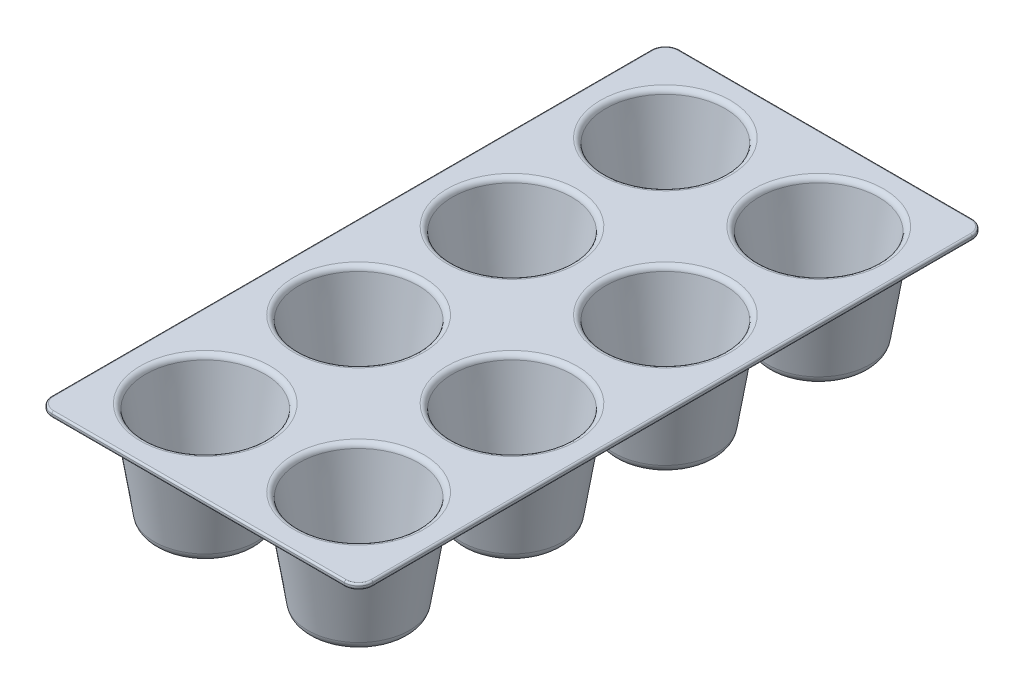
from build123d import *

# Parameters (mm, degrees)
LPATTERN1_COUNT      = 2
LPATTERN1_PITCH      = 86
LPATTERN1_COUNT_DIR2 = 4
LPATTERN1_PITCH_DIR2 = 86
BOSS_EXTRUDE1_START  = 58
BOSS_EXTRUDE1_DEPTH  = 3
FILLET1_R            = 1


with BuildPart() as part:
    # Sketch1 → Revolve1 (revolve)
    with BuildSketch(Plane.XY, mode=Mode.PRIVATE) as revolve1_sk:
        with BuildLine():
            Line((0, 0), (-22.602129613, 0))
            ThreePointArc((-22.602129613, 0), (-26.498817903, 1.437564206), (-28.528259657, 5.06139321))
            Line((-28.528259657, 5.06139321), (-36.036934978, 52.469303395))
            ThreePointArc((-36.036934978, 52.469303395), (-37.051655855, 54.281217897), (-39, 55))
            Line((-39, 55), (-47, 55))
            Line((-47, 55), (-47, 58))
            Line((-47, 58), (-36.437757944, 58))
            ThreePointArc((-36.437757944, 58), (-34.489413799, 57.281217897), (-33.474692922, 55.469303395))
            Line((-33.474692922, 55.469303395), (-25.9660176, 8.06139321))
            ThreePointArc((-25.9660176, 8.06139321), (-23.936575847, 4.437564206), (-20.039887557, 3))
            Line((-20.039887557, 3), (0, 3))
            Line((0, 3), (0, 0))
        make_face()
    revolve1 = revolve(revolve1_sk.sketch.rotate(Axis((0, 0, 0), (0, 1, 0)), 270), axis=Axis((0, 0, 0), (0, 1, 0)))

    # LPattern1: Revolve1 2 × 4
    with Locations(*[(i * LPATTERN1_PITCH, 0, -j * LPATTERN1_PITCH_DIR2) for i in range(LPATTERN1_COUNT) for j in range(LPATTERN1_COUNT_DIR2) if (i, j) != (0, 0)]):
        add(revolve1)

    # Sketch3 → Boss-Extrude1 (add)
    with BuildSketch(Plane(origin=(0, 0, 0), x_dir=(1, 0, 0), z_dir=(0, 1, 0)).offset(BOSS_EXTRUDE1_START)):
        with BuildLine():
            ThreePointArc((-47, -39), (-44.656854249, -44.656854249), (-39, -47))
            Line((-39, -47), (1.51e-07, -47))
            ThreePointArc((1.51e-07, -47), (-33.234018781, -33.234018651), (-47, 3.35e-07))
            Line((-47, 3.35e-07), (-47, -39))
        make_face()
        with BuildLine():
            ThreePointArc((43, -18.973665961), (25.663570546, -39.374879642), (1.51e-07, -47))
            Line((1.51e-07, -47), (86, -47))
            ThreePointArc((86, -47), (60.336429517, -39.374879683), (43, -18.973665961))
        make_face()
        with BuildLine():
            ThreePointArc((133, 0), (119.234018716, -33.234018716), (86, -47))
            Line((86, -47), (125, -47))
            ThreePointArc((125, -47), (130.656854249, -44.656854249), (133, -39))
            Line((133, -39), (133, 0))
        make_face()
        with BuildLine():
            ThreePointArc((104.973665961, 43), (125.374879683, 25.663570483), (133, 0))
            Line((133, 0), (133, 86))
            ThreePointArc((133, 86), (125.374879683, 60.336429517), (104.973665961, 43))
        make_face()
        with BuildLine():
            ThreePointArc((104.973665961, 129), (125.374879683, 111.663570483), (133, 86))
            Line((133, 86), (133, 172))
            ThreePointArc((133, 172), (125.374879683, 146.336429517), (104.973665961, 129))
        make_face()
        with BuildLine():
            ThreePointArc((67.026334039, 43), (52.765981284, 33.234018716), (43, 18.973665961))
            ThreePointArc((43, 18.973665961), (33.234018716, 33.234018716), (18.973665961, 43))
            ThreePointArc((18.973665961, 43), (33.234018716, 52.765981284), (43, 67.026334039))
            ThreePointArc((43, 67.026334039), (52.765981284, 52.765981284), (67.026334039, 43))
        make_face()
        with BuildLine():
            ThreePointArc((18.973665961, 129), (33.234018716, 138.765981284), (43, 153.026334039))
            ThreePointArc((43, 153.026334039), (52.765981284, 138.765981284), (67.026334039, 129))
            ThreePointArc((67.026334039, 129), (52.765981284, 119.234018716), (43, 104.973665961))
            ThreePointArc((43, 104.973665961), (33.234018716, 119.234018716), (18.973665961, 129))
        make_face()
        with BuildLine():
            Line((-47, 172), (-47, 85.999999906))
            ThreePointArc((-47, 85.999999906), (-39.374879709, 111.663570443), (-18.973665961, 129))
            ThreePointArc((-18.973665961, 129), (-39.374879683, 146.336429517), (-47, 172))
        make_face()
        with BuildLine():
            Line((-47, 85.999999906), (-47, 3.35e-07))
            ThreePointArc((-47, 3.35e-07), (-39.374879592, 25.663570623), (-18.973665961, 43))
            ThreePointArc((-18.973665961, 43), (-39.374879658, 60.336429478), (-47, 85.999999906))
        make_face()
        with BuildLine():
            ThreePointArc((104.973665961, 215), (125.374879683, 197.663570483), (133, 172))
            Line((133, 172), (133, 258))
            ThreePointArc((133, 258), (125.374879683, 232.336429517), (104.973665961, 215))
        make_face()
        with BuildLine():
            ThreePointArc((43, 190.973665961), (33.234018716, 205.234018716), (18.973665961, 215))
            ThreePointArc((18.973665961, 215), (33.234018716, 224.765981284), (43, 239.026334039))
            ThreePointArc((43, 239.026334039), (52.765981284, 224.765981284), (67.026334039, 215))
            ThreePointArc((67.026334039, 215), (52.765981284, 205.234018716), (43, 190.973665961))
        make_face()
        with BuildLine():
            Line((-47, 258.000000209), (-47, 172))
            ThreePointArc((-47, 172), (-39.374879683, 197.663570483), (-18.973665961, 215))
            ThreePointArc((-18.973665961, 215), (-39.374879741, 232.336429605), (-47, 258.000000209))
        make_face()
        with BuildLine():
            Line((-47, 297), (-47, 258.000000209))
            ThreePointArc((-47, 258.000000209), (-33.234018535, 291.234018897), (3.03e-07, 305))
            Line((3.03e-07, 305), (-39, 305))
            ThreePointArc((-39, 305), (-44.656854249, 302.656854249), (-47, 297))
        make_face()
        with BuildLine():
            Line((86, 305), (3.03e-07, 305))
            ThreePointArc((3.03e-07, 305), (25.663570609, 297.374879601), (43, 276.973665961))
            ThreePointArc((43, 276.973665961), (60.336429517, 297.374879683), (86, 305))
        make_face()
        with BuildLine():
            ThreePointArc((86, 305), (119.234018716, 291.234018716), (133, 258))
            Line((133, 258), (133, 297))
            ThreePointArc((133, 297), (130.656854249, 302.656854249), (125, 305))
            Line((125, 305), (86, 305))
        make_face()
    extrude(amount=-BOSS_EXTRUDE1_DEPTH)

    # Fillet1
    fillet1_edges = [part.edges().sort_by_distance(p)[0] for p in [
        (-44.656854249, 58, 44.656854249),
        (-47, 58, -129),
        (43, 55, 47),
        (-44.656854249, 55, 44.656854249),
        (-47, 55, -129),
        (43, 58, 47),
        (130.656854249, 58, 44.656854249),
        (133, 55, -129),
        (130.656854249, 55, 44.656854249),
        (133, 58, -129),
        (-44.656854249, 58, -302.656854249),
        (43, 58, -305),
        (-44.656854249, 55, -302.656854249),
        (43, 55, -305),
        (130.656854249, 58, -302.656854249),
        (130.656854249, 55, -302.656854249),
    ]]
    fillet(fillet1_edges, radius=FILLET1_R)


solid = part.part
